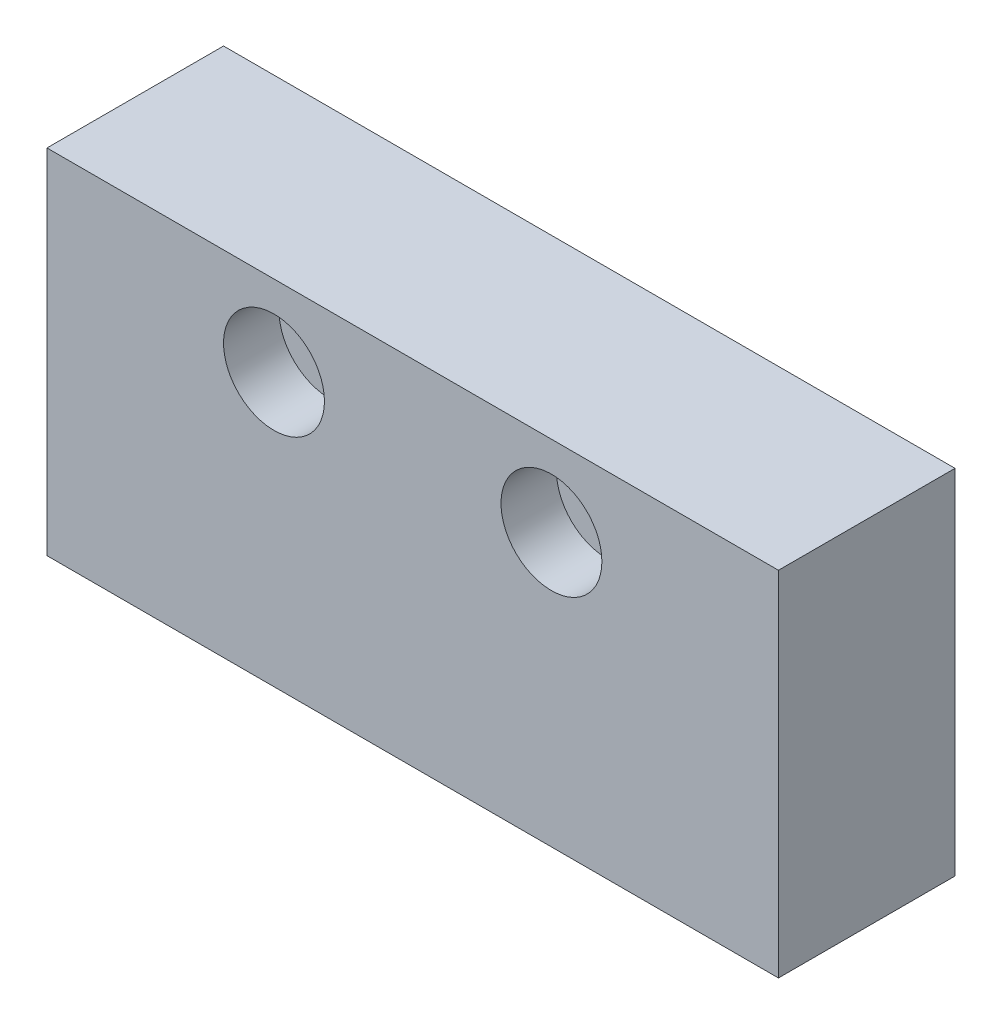
from build123d import *

# Parameters (mm, degrees)
SKETCH1_W                                           = 58
SKETCH1_H                                           = 28
BOSS_EXTRUDE1_DEPTH                                 = 7
CBORE_FOR_M4_HEX_SOCKET_HEAD_CAP_SCREW1_D           = 4.3
CBORE_FOR_M4_HEX_SOCKET_HEAD_CAP_SCREW1_CBORE_D     = 8
CBORE_FOR_M4_HEX_SOCKET_HEAD_CAP_SCREW1_CBORE_DEPTH = 4.4


with BuildPart() as part:
    # Sketch1 → Boss-Extrude1 (new, symmetric)
    with BuildSketch(Plane.XY):
        Rectangle(SKETCH1_W, SKETCH1_H)
    extrude(amount=BOSS_EXTRUDE1_DEPTH, both=True)

    # CBORE for M4 Hex Socket Head Cap Screw1 (through all)
    with Locations(Plane.XY.offset(7)):
        with Locations((-11, 7.6), (11, 7.6)):
            CounterBoreHole(CBORE_FOR_M4_HEX_SOCKET_HEAD_CAP_SCREW1_D / 2, CBORE_FOR_M4_HEX_SOCKET_HEAD_CAP_SCREW1_CBORE_D / 2, CBORE_FOR_M4_HEX_SOCKET_HEAD_CAP_SCREW1_CBORE_DEPTH)


solid = part.part
